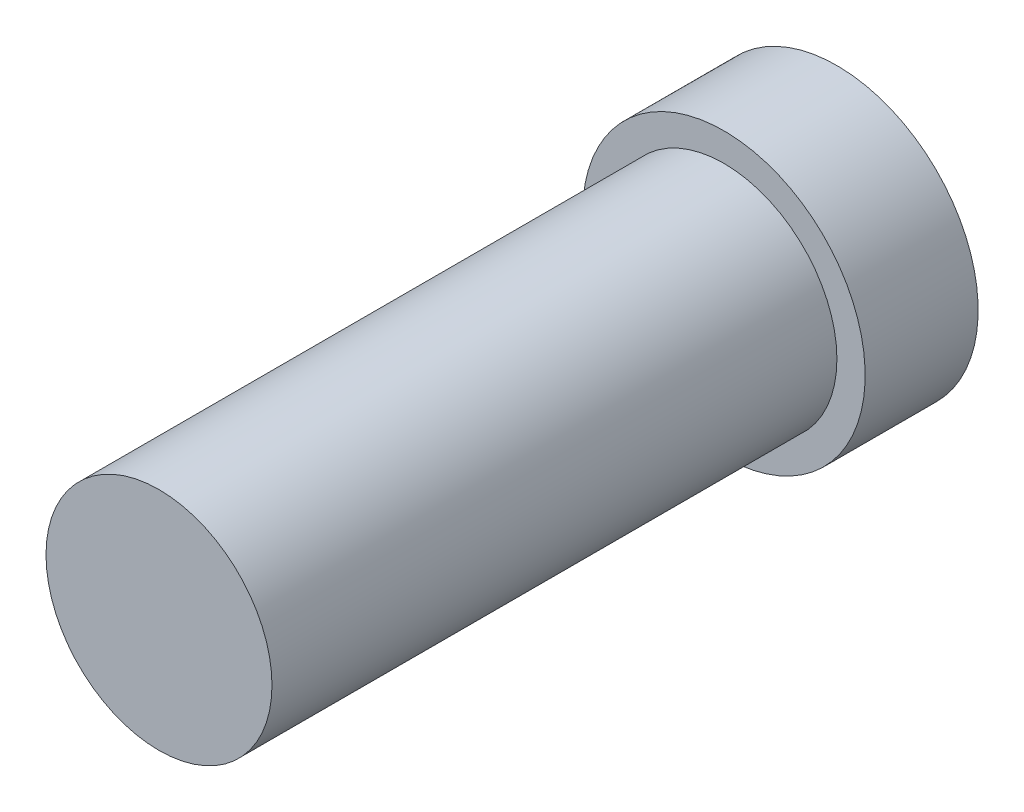
from build123d import *

# Parameters (mm, degrees)
IZIM1_R                     = 2
Y_KSEKLIK_EKSTR_ZYON1_DEPTH = 10
IZIM2_R                     = 2.5
Y_KSEKLIK_EKSTR_ZYON2_DEPTH = 2


with BuildPart() as part:
    # Çizim1 → Yükseklik-Ekstrüzyon1 (new body)
    with BuildSketch(Plane.XY):
        Circle(IZIM1_R)
    extrude(amount=Y_KSEKLIK_EKSTR_ZYON1_DEPTH)

    # Çizim2 → Yükseklik-Ekstrüzyon2 (add)
    with BuildSketch(Plane(origin=(0, 0, 0), x_dir=(-1, 0, 0), z_dir=(0, 0, -1))):
        Circle(IZIM2_R)
    extrude(amount=Y_KSEKLIK_EKSTR_ZYON2_DEPTH)


solid = part.part
